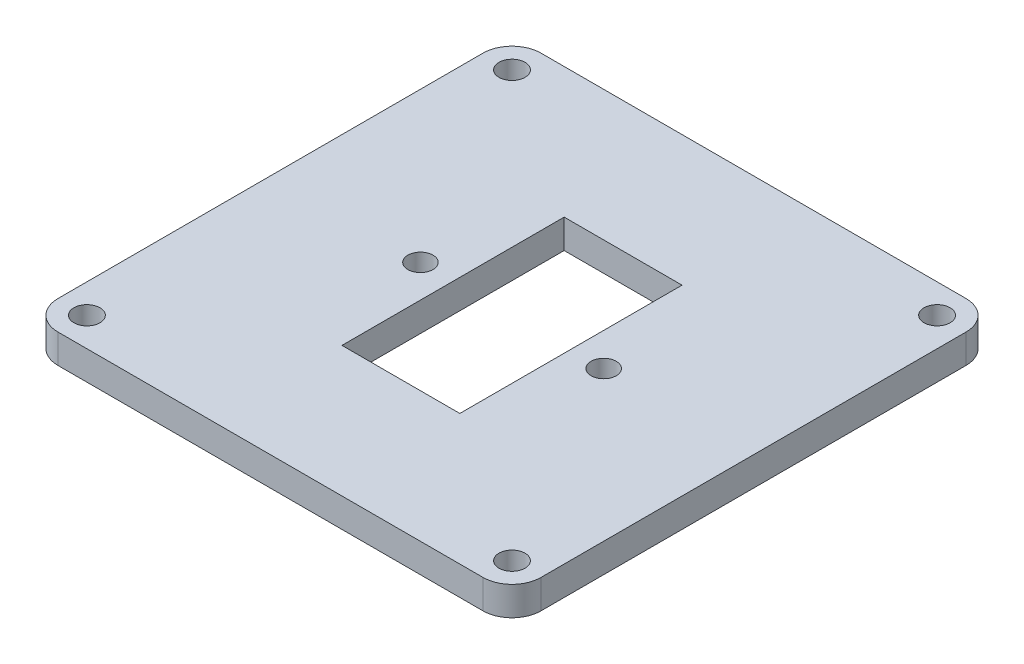
from build123d import *

# Parameters (mm, degrees)
SKETCH_1_R      = 1.35
SKETCH_1_R_2    = 1.3
SKETCH_1_W      = 12.200420097
SKETCH_1_H      = 23.000703054
EXTRUDE_1_DEPTH = 3


with BuildPart() as part:
    # 草图1 → 凸台-拉伸1 (new body)
    with BuildSketch(Plane.XZ.offset(0.906223555)):
        with BuildLine():
            Line((-25.648543234, 0), (18.351102305, 0))
            ThreePointArc((18.351102305, 0), (20.472422649, 0.878679656), (21.351102305, 3))
            Line((21.351102305, 3), (21.351102305, 46.999948986))
            ThreePointArc((21.351102305, 46.999948986), (20.472422649, 49.12126933), (18.351102305, 49.999948986))
            Line((18.351102305, 49.999948986), (-25.648543234, 49.999948986))
            ThreePointArc((-25.648543234, 49.999948986), (-27.769863578, 49.12126933), (-28.648543234, 46.999948986))
            Line((-28.648543234, 46.999948986), (-28.648543234, 3))
            ThreePointArc((-28.648543234, 3), (-27.769863578, 0.878679656), (-25.648543234, 0))
        make_face()
        with Locations(Location((18.351102305, 46.999948986, 0), (0, 0, 90))):
            Circle(SKETCH_1_R, mode=Mode.SUBTRACT)
        with Locations(Location((-25.648543234, 3, 0), (0, 0, 90))):
            Circle(SKETCH_1_R, mode=Mode.SUBTRACT)
        with Locations(Location((-25.648543234, 46.999948986, 0), (0, 0, 90))):
            Circle(SKETCH_1_R, mode=Mode.SUBTRACT)
        with Locations(Location((18.351102305, 3, 0), (0, 0, 90))):
            Circle(SKETCH_1_R, mode=Mode.SUBTRACT)
        with Locations(Location((5.870533839, 25.026548182, 0), (0, 0, 90))):
            Circle(SKETCH_1_R_2, mode=Mode.SUBTRACT)
        with Locations(Location((-13.129904617, 24.994501462, 0), (0, 0, 90))):
            Circle(SKETCH_1_R_2, mode=Mode.SUBTRACT)
        with Locations((-3.648510984, 25.000507943)):
            Rectangle(SKETCH_1_W, SKETCH_1_H, mode=Mode.SUBTRACT)
    extrude(amount=-EXTRUDE_1_DEPTH)


solid = part.part
